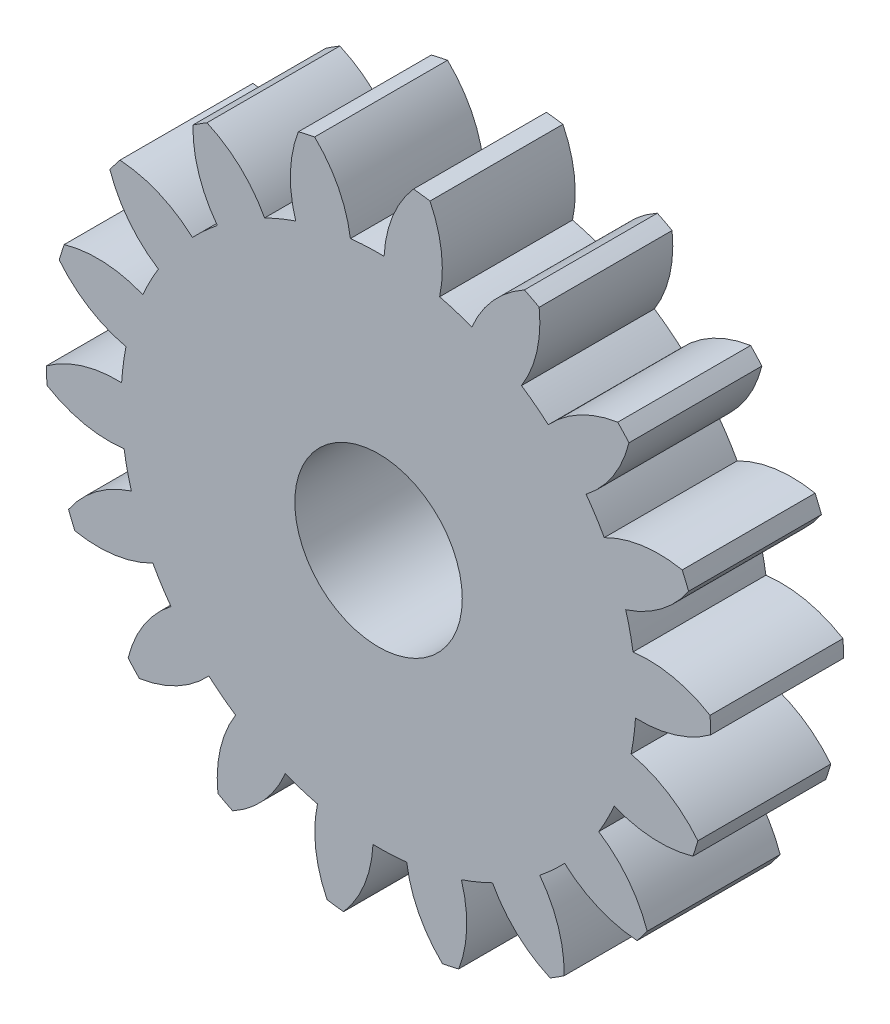
from build123d import *

# Parameters (mm, degrees)
SKETCH5_R           = 0.396875
BOSS_EXTRUDE2_DEPTH = 6.35
SKETCH6_R           = 2.9972
CUT_EXTRUDE1_DEPTH  = 258.501368276
SKETCH7_R           = 4.0005
CUT_EXTRUDE2_DEPTH  = 258.501368276


with BuildPart() as part:
    # Sketch5 → Boss-Extrude2 (new body)
    with BuildSketch(Plane(origin=(0, 0, 46.616707813), x_dir=(-1, 0, 0), z_dir=(0, 0, -1))):
        with BuildLine():
            ThreePointArc((246.921074011, -32.476835359), (246.808601397, -30.573015348), (246.075978074, -28.812207638))
            ThreePointArc((246.075978074, -28.812207638), (246.731600791, -28.342840277), (247.355067366, -27.831531862))
            ThreePointArc((247.355067366, -27.831531862), (248.865338892, -28.996117901), (250.674701217, -29.598935203))
            ThreePointArc((250.674701217, -29.598935203), (250.946601365, -29.309785139), (251.211187708, -29.013927881))
            ThreePointArc((251.211187708, -29.013927881), (250.454353229, -27.263390165), (249.163680793, -25.859344087))
            ThreePointArc((249.163680793, -25.859344087), (249.61923153, -25.194046866), (250.030220693, -24.500335994))
            ThreePointArc((250.030220693, -24.500335994), (251.847723585, -25.078145617), (253.754143671, -25.025770226))
            ThreePointArc((253.754143671, -25.025770226), (253.910751087, -24.661062717), (254.058191779, -24.292553976))
            ThreePointArc((254.058191779, -24.292553976), (252.748280843, -22.906439239), (251.055233439, -22.028503472))
            ThreePointArc((251.055233439, -22.028503472), (251.255766054, -21.247521054), (251.404706445, -20.455079495))
            ThreePointArc((251.404706445, -20.455079495), (253.310223032, -20.376420334), (255.083758479, -19.675169494))
            ThreePointArc((255.083758479, -19.675169494), (255.106183999, -19.278893649), (255.118695516, -18.882181018))
            ThreePointArc((255.118695516, -18.882181018), (253.413702715, -18.027675153), (251.522486845, -17.781741707))
            ThreePointArc((251.522486845, -17.781741707), (251.443814146, -16.979272099), (251.312741357, -16.183679999))
            ThreePointArc((251.312741357, -16.183679999), (253.076438214, -15.45803951), (254.503174475, -14.192494423))
            ThreePointArc((254.503174475, -14.192494423), (254.388713248, -13.812446955), (254.264786518, -13.435379832))
            ThreePointArc((254.264786518, -13.435379832), (252.370359146, -13.215548859), (250.509083356, -13.631280938))
            ThreePointArc((250.509083356, -13.631280938), (250.16069443, -12.904113816), (249.765417774, -12.201331325))
            ThreePointArc((249.765417774, -12.201331325), (251.174567032, -10.91623246), (252.082418656, -9.23903654))
            ThreePointArc((252.082418656, -9.23903654), (251.844876396, -8.921056785), (251.599458811, -8.60911503))
            ThreePointArc((251.599458811, -8.60911503), (249.744092768, -9.050473808), (248.137254388, -10.077727986))
            ThreePointArc((248.137254388, -10.077727986), (247.561170083, -9.513570439), (246.949365757, -8.988363496))
            ThreePointArc((246.949365757, -8.988363496), (247.834003218, -7.298808145), (248.113469901, -5.412255973))
            ThreePointArc((248.113469901, -5.412255973), (247.781497711, -5.19469698), (247.444190253, -4.985505373))
            ThreePointArc((247.444190253, -4.985505373), (245.851670066, -6.03481952), (244.69307752, -7.549693784))
            ThreePointArc((244.69307752, -7.549693784), (243.958782103, -7.216591536), (243.204242739, -6.932307851))
            ThreePointArc((243.204242739, -6.932307851), (243.457668071, -5.042081324), (243.075042005, -3.173718934))
            ThreePointArc((243.075042005, -3.173718934), (242.688680631, -3.08282153), (242.300167558, -3.001611666))
            ThreePointArc((242.300167558, -3.001611666), (241.162574665, -4.532318409), (240.591971311, -6.352096565))
            ThreePointArc((240.591971311, -6.352096565), (239.788031649, -6.290226665), (238.981765829, -6.281155045))
            ThreePointArc((238.981765829, -6.281155045), (238.573412195, -4.418246557), (237.574843733, -2.793426028))
            ThreePointArc((237.574843733, -2.793426028), (237.180694057, -2.840153782), (236.78783578, -2.896720768))
            ThreePointArc((236.78783578, -2.896720768), (236.242380673, -4.724194283), (236.328589698, -6.629384229))
            ThreePointArc((236.328589698, -6.629384229), (235.551972777, -6.846209099), (234.79122806, -7.113443716))
            ThreePointArc((234.79122806, -7.113443716), (233.770348935, -5.502547525), (232.27628017, -4.317246193))
            ThreePointArc((232.27628017, -4.317246193), (231.921882461, -4.495963046), (231.572063485, -4.68348407))
            ThreePointArc((231.572063485, -4.68348407), (231.6845361, -6.587304081), (232.417159423, -8.348111791))
            ThreePointArc((232.417159423, -8.348111791), (231.761536706, -8.817479152), (231.138070131, -9.328787567))
            ThreePointArc((231.138070131, -9.328787567), (229.627798605, -8.164201528), (227.818436279, -7.561384226))
            ThreePointArc((227.818436279, -7.561384226), (227.546536131, -7.850534289), (227.281949789, -8.146391548))
            ThreePointArc((227.281949789, -8.146391548), (228.038784268, -9.896929264), (229.329456703, -11.300975342))
            ThreePointArc((229.329456703, -11.300975342), (228.873905967, -11.966272563), (228.462916804, -12.659983435))
            ThreePointArc((228.462916804, -12.659983435), (226.645413911, -12.082173811), (224.738993826, -12.134549203))
            ThreePointArc((224.738993826, -12.134549203), (224.582386409, -12.499256711), (224.434945718, -12.867765452))
            ThreePointArc((224.434945718, -12.867765452), (225.744856653, -14.25388019), (227.437904058, -15.131815957))
            ThreePointArc((227.437904058, -15.131815957), (227.237371443, -15.912798374), (227.088431051, -16.705239934))
            ThreePointArc((227.088431051, -16.705239934), (225.182914465, -16.783899095), (223.409379017, -17.485149934))
            ThreePointArc((223.409379017, -17.485149934), (223.386953498, -17.88142578), (223.374441981, -18.278138411))
            ThreePointArc((223.374441981, -18.278138411), (225.079434782, -19.132644276), (226.970650651, -19.378577722))
            ThreePointArc((226.970650651, -19.378577722), (227.049323351, -20.18104733), (227.18039614, -20.97663943))
            ThreePointArc((227.18039614, -20.97663943), (225.416699282, -21.702279919), (223.989963022, -22.967825006))
            ThreePointArc((223.989963022, -22.967825006), (224.104424249, -23.347872473), (224.228350979, -23.724939596))
            ThreePointArc((224.228350979, -23.724939596), (226.122778351, -23.944770569), (227.98405414, -23.529038491))
            ThreePointArc((227.98405414, -23.529038491), (228.332443066, -24.256205612), (228.727719723, -24.958988104))
            ThreePointArc((228.727719723, -24.958988104), (227.318570464, -26.244086969), (226.410718841, -27.921282889))
            ThreePointArc((226.410718841, -27.921282889), (226.6482611, -28.239262644), (226.893678686, -28.551204399))
            ThreePointArc((226.893678686, -28.551204399), (228.749044729, -28.109845621), (230.355883108, -27.082591442))
            ThreePointArc((230.355883108, -27.082591442), (230.931967414, -27.64674899), (231.54377174, -28.171955932))
            ThreePointArc((231.54377174, -28.171955932), (230.659134278, -29.861511284), (230.379667596, -31.748063456))
            ThreePointArc((230.379667596, -31.748063456), (230.711639785, -31.965622448), (231.048947243, -32.174814056))
            ThreePointArc((231.048947243, -32.174814056), (232.64146743, -31.125499909), (233.800059977, -29.610625645))
            ThreePointArc((233.800059977, -29.610625645), (234.534355393, -29.943727892), (235.288894757, -30.228011577))
            ThreePointArc((235.288894757, -30.228011577), (235.035469426, -32.118238105), (235.418095491, -33.986600495))
            ThreePointArc((235.418095491, -33.986600495), (235.804456866, -34.077497898), (236.192969938, -34.158707763))
            ThreePointArc((236.192969938, -34.158707763), (237.330562832, -32.62800102), (237.901166185, -30.808222864))
            ThreePointArc((237.901166185, -30.808222864), (238.705105848, -30.870092764), (239.511371667, -30.879164384))
            ThreePointArc((239.511371667, -30.879164384), (239.919725301, -32.742072872), (240.918293764, -34.3668934))
            ThreePointArc((240.918293764, -34.3668934), (241.312443439, -34.320165647), (241.705301716, -34.263598661))
            ThreePointArc((241.705301716, -34.263598661), (242.250756824, -32.436125145), (242.164547799, -30.5309352))
            ThreePointArc((242.164547799, -30.5309352), (242.94116472, -30.31411033), (243.701909437, -30.046875713))
            ThreePointArc((243.701909437, -30.046875713), (244.722788562, -31.657771904), (246.216857327, -32.843073236))
            ThreePointArc((246.216857327, -32.843073236), (246.571255036, -32.664356383), (246.921074011, -32.476835359))
        make_face()
        with Locations((239.246568748, -18.580159714)):
            Circle(SKETCH5_R, mode=Mode.SUBTRACT)
    extrude(amount=-BOSS_EXTRUDE2_DEPTH)

    # Sketch6 → Cut-Extrude1 (cut, through all)
    with BuildSketch(Plane.XY.offset(52.966707813)):
        with Locations((-239.246568748, -18.580159714)):
            Circle(SKETCH6_R)
    extrude(amount=-CUT_EXTRUDE1_DEPTH, mode=Mode.SUBTRACT)

    # Sketch7 → Cut-Extrude2 (cut, through all)
    with BuildSketch(Plane.XY.offset(52.966707813)):
        with Locations((-239.246568748, -18.580159714)):
            Circle(SKETCH7_R)
    extrude(amount=-CUT_EXTRUDE2_DEPTH, mode=Mode.SUBTRACT)


solid = part.part
